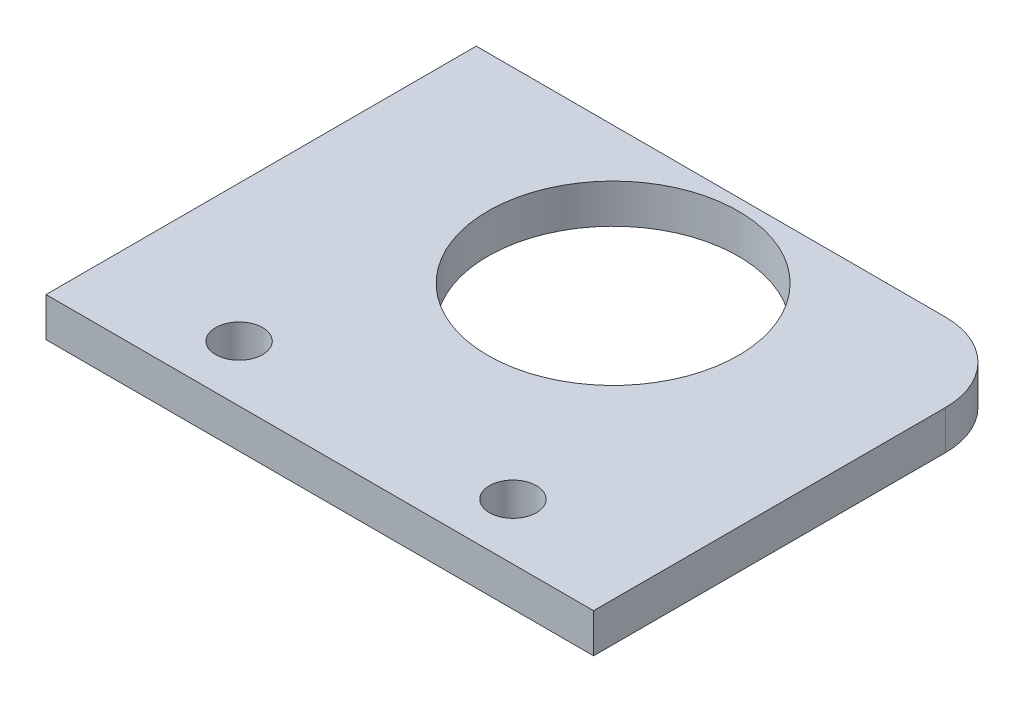
from build123d import *

# Parameters (mm, degrees)
SKETCH1_W           = 70
SKETCH1_H           = 55
SKETCH1_R           = 16
BOSS_EXTRUDE1_DEPTH = 5
SKETCH2_R           = 3
CUT_EXTRUDE1_DEPTH  = 45.791182168
FILLET1_R           = 10


with BuildPart() as part:
    # Sketch1 → Boss-Extrude1 (new body)
    with BuildSketch(Plane(origin=(0, 0, 0), x_dir=(1, 0, 0), z_dir=(0, 1, 0))):
        Rectangle(SKETCH1_W, SKETCH1_H)
        with Locations(Location((0, 10, 0), (0, 0, 270))):
            Circle(SKETCH1_R, mode=Mode.SUBTRACT)
    extrude(amount=BOSS_EXTRUDE1_DEPTH)

    # Sketch2 → Cut-Extrude1 (cut, through all)
    with BuildSketch(Plane(origin=(0, 5, 0), x_dir=(1, 0, 0), z_dir=(0, 1, 0))):
        with Locations(Location((-17.5, -20.310889132, 0), (0, 0, 270))):
            Circle(SKETCH2_R)
        with Locations(Location((17.5, -20.310889132, 0), (0, 0, 270))):
            Circle(SKETCH2_R)
    extrude(amount=-CUT_EXTRUDE1_DEPTH, mode=Mode.SUBTRACT)

    # Fillet1
    fillet1_edges = [part.edges().sort_by_distance(p)[0] for p in [
        (35, 2.5, -27.5),
    ]]
    fillet(fillet1_edges, radius=FILLET1_R)


solid = part.part
